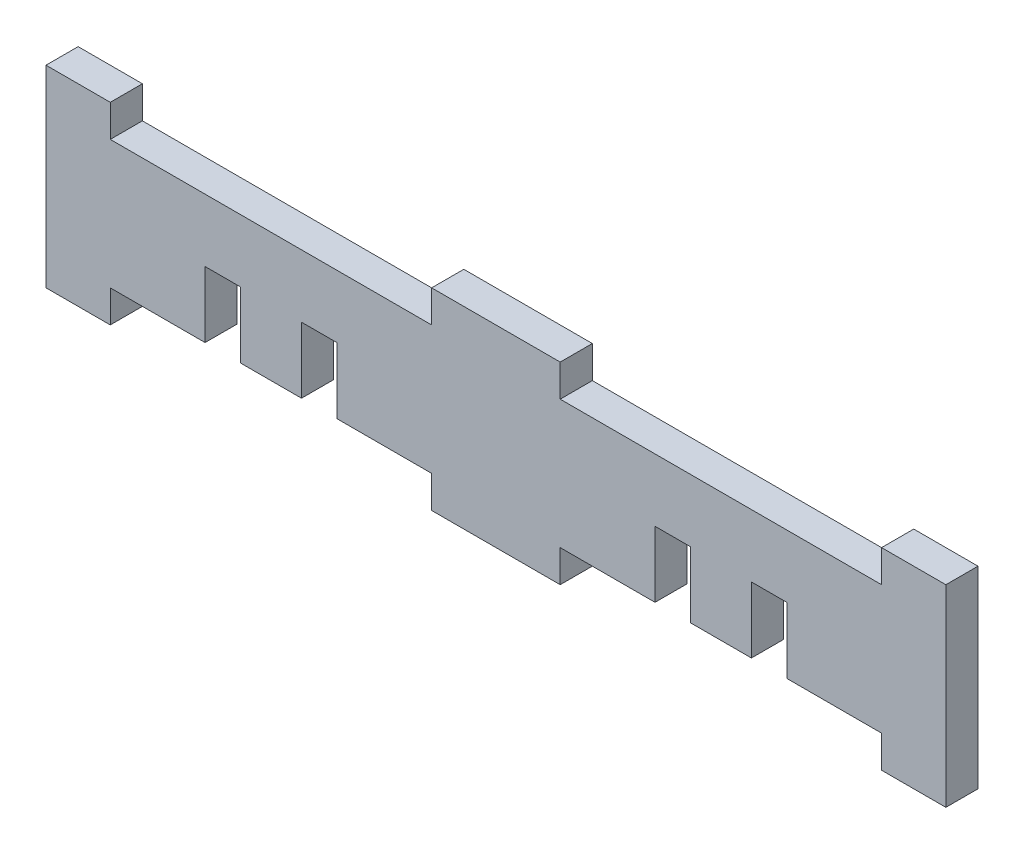
from build123d import *

# Parameters (mm, degrees)
BOSS_EXTRUDE1_DEPTH = 2.5


with BuildPart() as part:
    # Sketch2 → Boss-Extrude1 (new, symmetric)
    with BuildSketch(Plane.XY):
        Polygon((-1336.454343847, -212.29700175), (-1336.454343847, -207.29700175), (-1321.70434708, -207.29700175), (-1321.70434708, -197.04700175), (-1316.20434708, -197.04700175), (-1316.20434708, -207.29700175), (-1306.70434708, -207.29700175), (-1306.70434708, -197.04700175), (-1301.20434708, -197.04700175), (-1301.20434708, -207.29700175), (-1286.454340614, -207.29700175), (-1286.454340614, -212.29700175), (-1276.454340614, -212.29700175), (-1276.454340614, -182.29700175), (-1286.454340614, -182.29700175), (-1286.454340614, -187.29700175), (-1336.454343847, -187.29700175), (-1336.454343847, -182.29700175), (-1356.454343847, -182.29700175), (-1356.454343847, -187.29700175), (-1406.454340614, -187.29700175), (-1406.454340614, -182.29700175), (-1416.454340614, -182.29700175), (-1416.454340614, -212.29700175), (-1406.454340614, -212.29700175), (-1406.454340614, -207.29700175), (-1391.704340614, -207.29700175), (-1391.704340614, -197.04700175), (-1386.204340614, -197.04700175), (-1386.204340614, -207.29700175), (-1376.704340614, -207.29700175), (-1376.704340614, -197.04700175), (-1371.204340614, -197.04700175), (-1371.204340614, -207.29700175), (-1356.454343847, -207.29700175), (-1356.454343847, -212.29700175), align=None)
    extrude(amount=BOSS_EXTRUDE1_DEPTH, both=True)


solid = part.part
